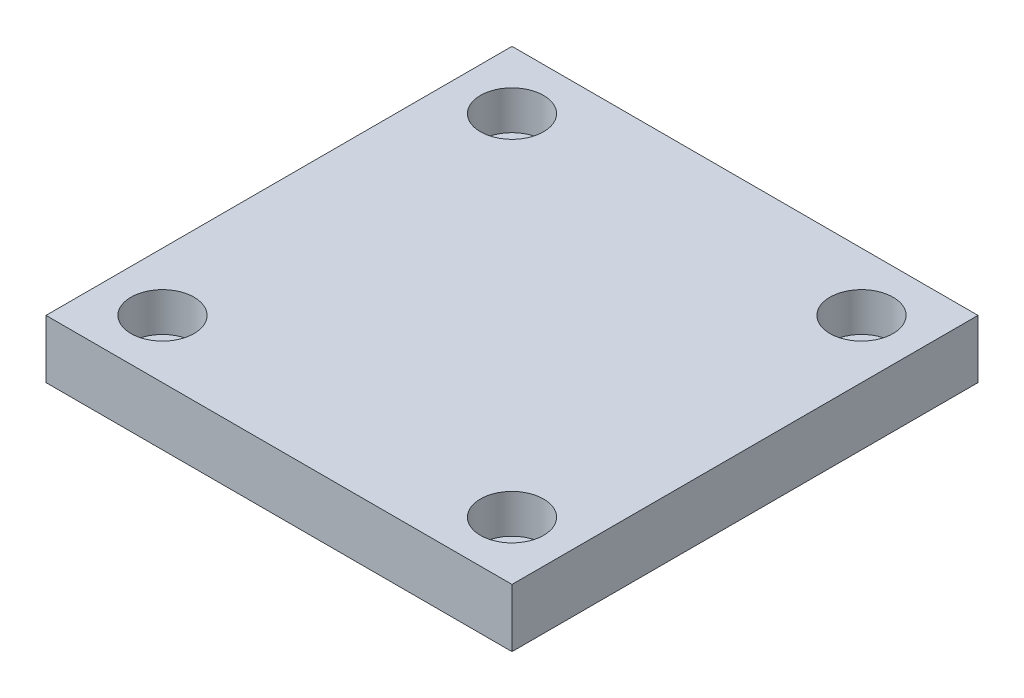
from build123d import *

# Parameters (mm, degrees)
SKETCH1_W                                        = 76.2
SKETCH1_H                                        = 76.2
BOSS_EXTRUDE1_DEPTH                              = 19.05
CBORE_FOR_1_2_SOCKET_HEAD_CAP_SCREW1_D           = 13.49248
CBORE_FOR_1_2_SOCKET_HEAD_CAP_SCREW1_CBORE_D     = 20.6375
CBORE_FOR_1_2_SOCKET_HEAD_CAP_SCREW1_CBORE_DEPTH = 12.7


with BuildPart() as part:
    # Sketch1 → Boss-Extrude1 (new body)
    with BuildSketch(Plane(origin=(0, 0, 0), x_dir=(1, 0, 0), z_dir=(0, 1, 0))):
        with Locations((38.1, 38.1)):
            Rectangle(SKETCH1_W, SKETCH1_H)
    extrude(amount=BOSS_EXTRUDE1_DEPTH)

    # CBORE for 1/2 Socket Head Cap Screw1 (through all)
    with Locations(Plane(origin=(0, 19.05, 0), x_dir=(1, 0, 0), z_dir=(0, 1, 0))):
        with Locations((57.15, 57.15)):
            CounterBoreHole(CBORE_FOR_1_2_SOCKET_HEAD_CAP_SCREW1_D / 2, CBORE_FOR_1_2_SOCKET_HEAD_CAP_SCREW1_CBORE_D / 2, CBORE_FOR_1_2_SOCKET_HEAD_CAP_SCREW1_CBORE_DEPTH)

    # Mirror1: part across plane


with BuildPart() as part_1:
    add(part.part)
    add(part.part.mirror(Plane(origin=(0, 19.05, 0), x_dir=(1, 0, 0), z_dir=(0, 0, -1))))

    # Mirror2: part across plane


with BuildPart() as part_2:
    add(part_1.part)
    add(part_1.part.mirror(Plane(origin=(0, 19.05, 0), x_dir=(0, 0, 1), z_dir=(1, 0, 0))))


solid = part_2.part
